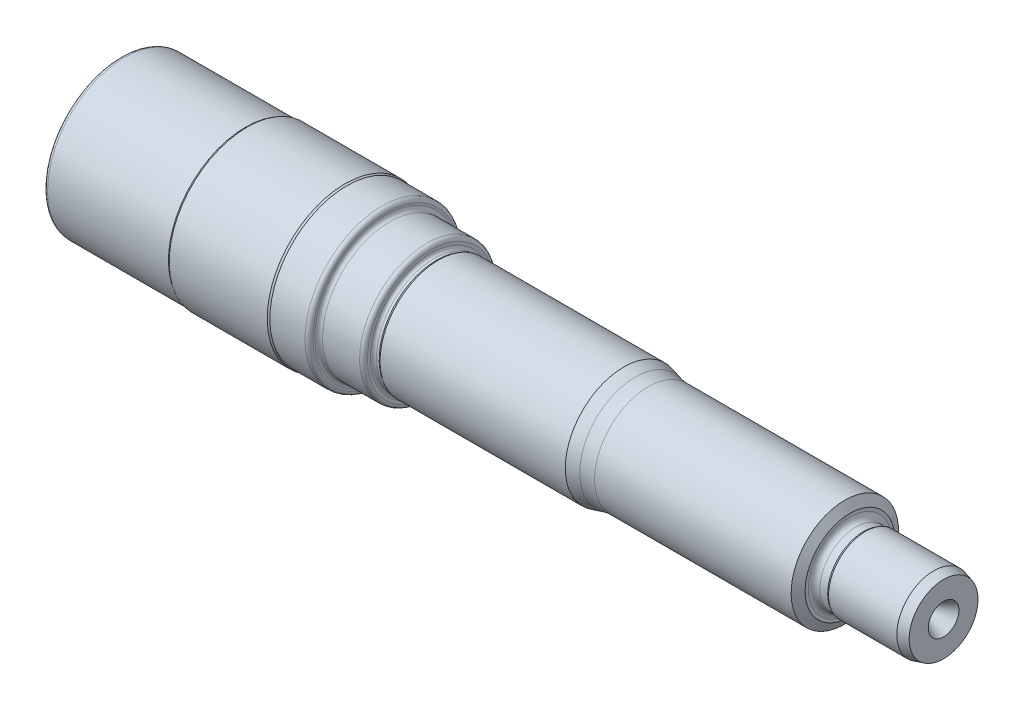
from build123d import *


with BuildPart() as part:
    # Sketch2 → Revolve1 (revolve)
    with BuildSketch(Plane.XY):
        with BuildLine():
            Line((0, 15.866025404), (0, 18.75))
            ThreePointArc((0, 18.75), (0.292893219, 19.457106781), (1, 19.75))
            Line((1, 19.75), (32, 19.75))
            Line((32, 19.75), (32.433012702, 20))
            Line((32.433012702, 20), (57.566987298, 20))
            Line((57.566987298, 20), (58, 19.75))
            Line((58, 19.75), (67, 19.75))
            ThreePointArc((67, 19.75), (67.707106781, 19.457106781), (68, 18.75))
            Line((68, 18.75), (68, 18.25))
            ThreePointArc((68, 18.25), (68.292893219, 17.542893219), (69, 17.25))
            Line((69, 17.25), (78.5, 17.25))
            ThreePointArc((78.5, 17.25), (79.207106781, 16.957106781), (79.5, 16.25))
            Line((79.5, 16.25), (79.5, 15.5))
            ThreePointArc((79.5, 15.5), (79.734314575, 14.934314575), (80.3, 14.7))
            Line((80.3, 14.7), (80.980384758, 14.7))
            Line((80.980384758, 14.7), (81.5, 15))
            Line((81.5, 15), (129, 15))
            Line((129, 15), (131.918597122, 14.217964258))
            ThreePointArc((131.918597122, 14.217964258), (133.586404209, 13.886216802), (135.283244708, 13.775))
            Line((135.283244708, 13.775), (185.686528138, 13.775))
            Line((185.686528138, 13.775), (187, 11.5))
            Line((187, 11.5), (187, 10.7))
            ThreePointArc((187, 10.7), (187.439339828, 9.639339828), (188.5, 9.2))
            Line((188.5, 9.2), (190.480384758, 9.2))
            Line((190.480384758, 9.2), (191, 9.5))
            Line((191, 9.5), (208.5, 9.5))
            Line((208.5, 9.5), (211, 8.830127019))
            Line((211, 8.830127019), (211, 3.936751346))
            Line((211, 3.936751346), (206.909326674, 1.575))
            Line((206.909326674, 1.575), (204.909326674, 1.575))
            Line((204.909326674, 1.575), (204, 0))
            Line((204, 0), (63, 0))
            Line((63, 0), (63, 12.5))
            ThreePointArc((63, 12.5), (62.414213562, 13.914213562), (61, 14.5))
            Line((61, 14.5), (55.299048365, 14.5))
            Line((55.299048365, 14.5), (50, 11.8))
            Line((50, 11.8), (7.2, 11.8))
            Line((7.2, 11.8), (4, 15))
            Line((4, 15), (1.5, 15))
            Line((1.5, 15), (0, 15.866025404))
        make_face()
    revolve(axis=Axis((204, 0, 0), (-1, 0, 0)))


solid = part.part
